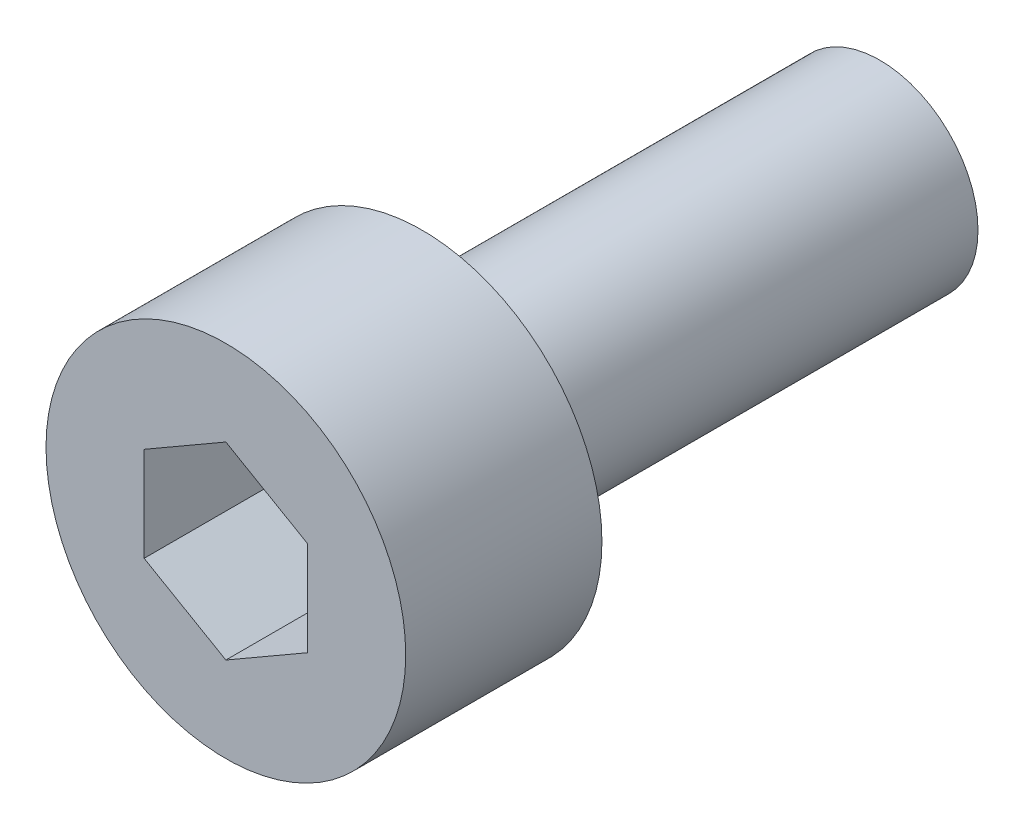
from build123d import *

# Parameters (mm, degrees)
THREAD_ENVELOPE_START = -7
PROFILE_1_R           = 1.5
THREAD_ENVELOPE_DEPTH = 7
PROFILE_2_R           = 2.75
SOCKET_HEAD_DEPTH     = 3


with BuildPart() as part:
    # Profile_1 → Thread_envelope (new body)
    with BuildSketch(Plane.XY.offset(THREAD_ENVELOPE_START)):
        Circle(PROFILE_1_R)
    extrude(amount=THREAD_ENVELOPE_DEPTH)

    # Profile_2 → Socket_head (add)
    with BuildSketch(Plane.XY):
        Circle(PROFILE_2_R)
        Polygon((1.25, 0.721687836), (0, 1.443375673), (-1.25, 0.721687836), (-1.25, -0.721687836), (0, -1.443375673), (1.25, -0.721687836), align=None, mode=Mode.SUBTRACT)
    extrude(amount=SOCKET_HEAD_DEPTH)


solid = part.part
